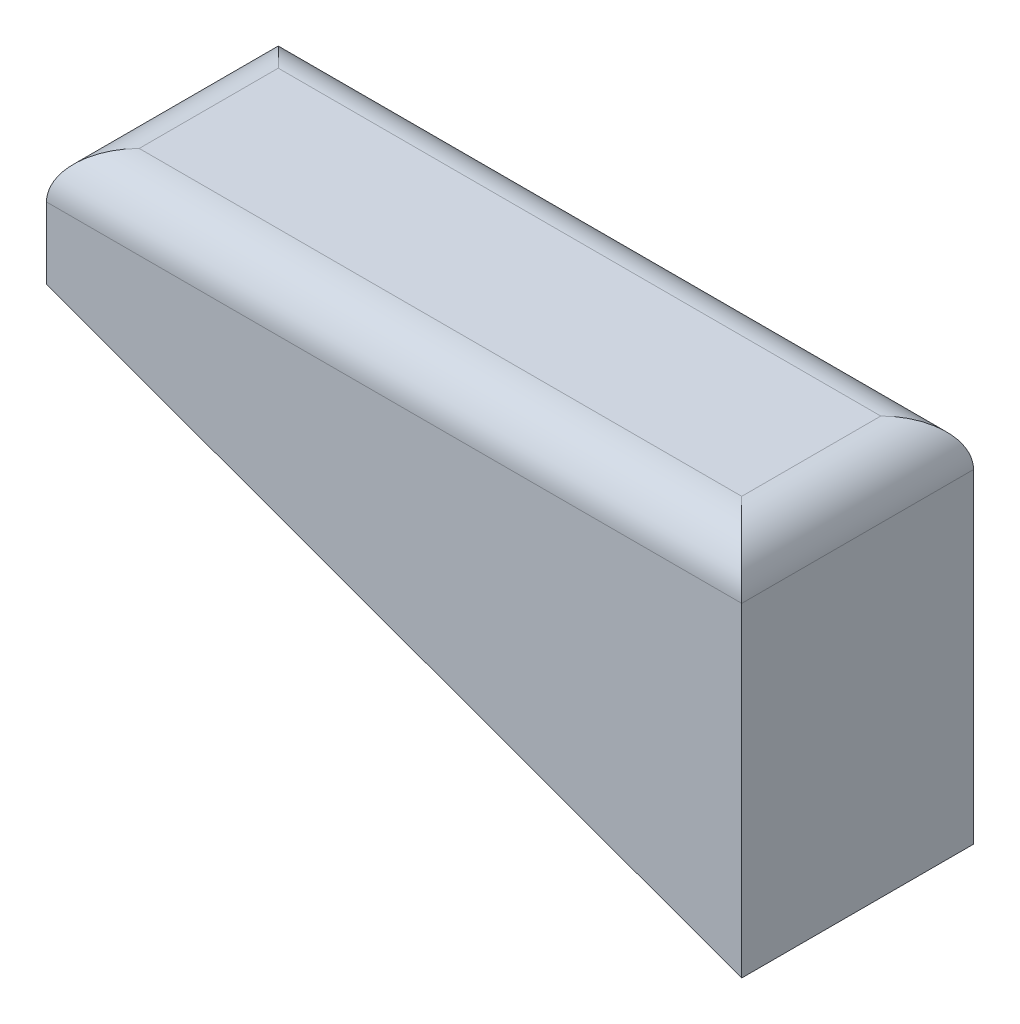
from build123d import *

# Parameters (mm, degrees)
SALIENTE_EXTRUIR1_DEPTH = 5
REDONDEO1_R             = 1


with BuildPart() as part:
    # Croquis1 → Saliente-Extruir1 (new body)
    with BuildSketch(Plane.XY):
        Polygon((0, 8), (0, 0), (-15, 5.459553514), (-15, 8), align=None)
    extrude(amount=SALIENTE_EXTRUIR1_DEPTH)

    # Redondeo1
    redondeo1_edges = [part.edges().sort_by_distance(p)[0] for p in [
        (-7.5, 8, 0),
        (-15, 8, 2.5),
        (0, 8, 2.5),
        (-7.5, 8, 5),
    ]]
    fillet(redondeo1_edges, radius=REDONDEO1_R)


solid = part.part
